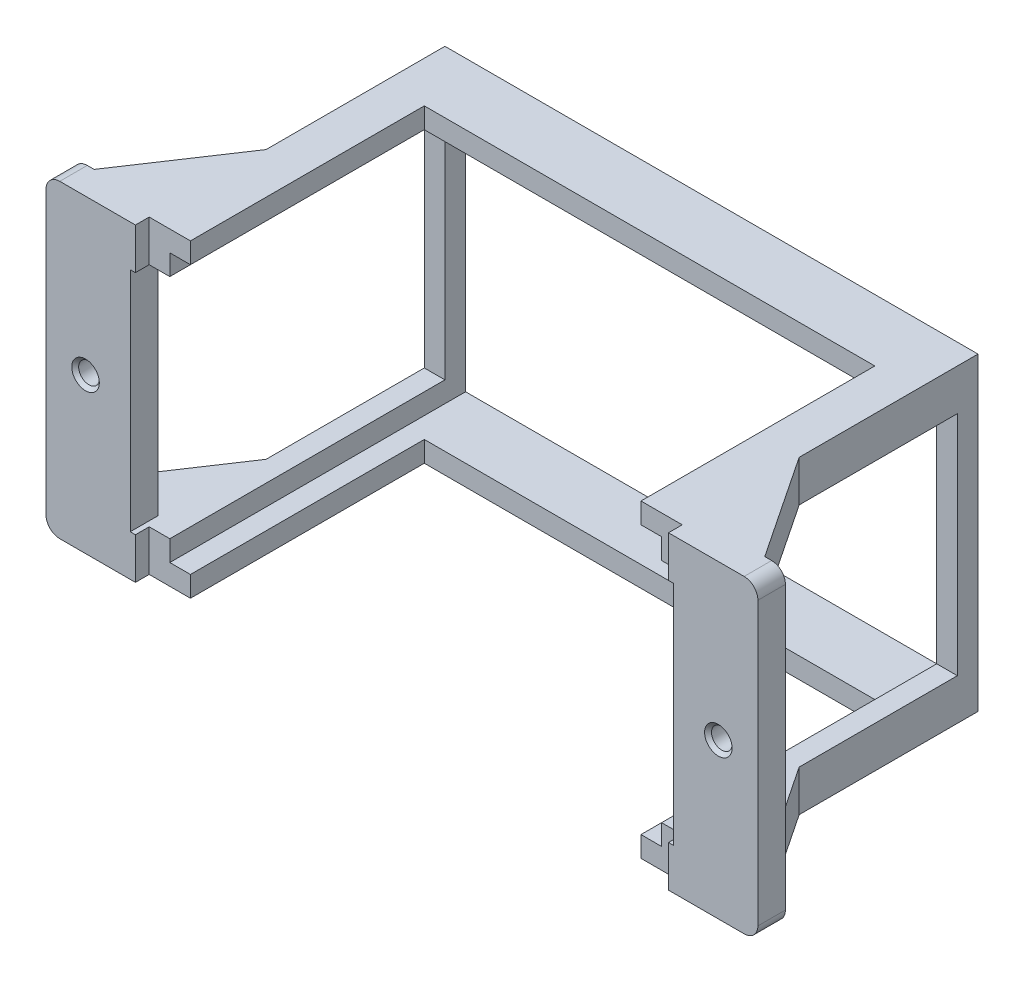
from build123d import *

# Parameters (mm, degrees)
SKETCH_1_W             = 77.5
SKETCH_1_H             = 45
SKETCH_1_W_2           = 71.5
SKETCH_1_H_2           = 39
EXTRUDE_1_DEPTH        = 3
SKETCH_2_W             = 3
SKETCH_2_H             = 3
EXTRUDE_2_DEPTH        = 40
SKETCH_3_W             = 3
SKETCH_3_H             = 3
EXTRUDE_3_DEPTH        = 40
EXTRUDE_4_DEPTH        = 2
EXTRUDE_4_DEPTH_BACK   = 2
EXTRUDE_4_2_DEPTH      = 2
EXTRUDE_4_2_DEPTH_BACK = 2
SKETCH_5_W             = 65.5
SKETCH_5_H             = 6
EXTRUDE_5_DEPTH        = 3
SKETCH_6_W             = 65.5
SKETCH_6_H             = 6
EXTRUDE_6_DEPTH        = 3
SKETCH_7_R             = 1.5
CUT_EXTRUDE_1_DEPTH    = 5
CHAMFER_1_SIZE         = 0.5
CHAMFER_2_SIZE         = 0.5
CHAMFER_3_SIZE         = 2
CHAMFER_4_SIZE         = 2
EXTRUDE_7_DEPTH        = 6
MIRROR_2_COPY_1_DEPTH  = 6
MIRROR_2_COPY_2_DEPTH  = 6
SKETCH_9_W             = 2
SKETCH_9_H             = 45
CUT_EXTRUDE_2_DEPTH    = 10
FILLET_1_R             = 2


with BuildPart() as part:
    # 草图1 → 凸台-拉伸1 (new body)
    with BuildSketch(Plane.XY):
        Rectangle(SKETCH_1_W, SKETCH_1_H)
        Rectangle(SKETCH_1_W_2, SKETCH_1_H_2, mode=Mode.SUBTRACT)
    extrude(amount=EXTRUDE_1_DEPTH)

    # 草图2 → 凸台-拉伸2 (add)
    with BuildSketch(Plane.XY.offset(3)):
        with Locations((37.25, 21)):
            Rectangle(SKETCH_2_W, SKETCH_2_H)
        with Locations((-37.25, 21)):
            Rectangle(SKETCH_2_W, SKETCH_2_H)
        with Locations((-37.25, -21)):
            Rectangle(SKETCH_2_W, SKETCH_2_H)
        with Locations((37.25, -21)):
            Rectangle(SKETCH_2_W, SKETCH_2_H)
    extrude(amount=EXTRUDE_2_DEPTH)

    # 草图3 → 凸台-拉伸3 (add)
    with BuildSketch(Plane.XY.offset(3)):
        with Locations((34.25, -21)):
            Rectangle(SKETCH_3_W, SKETCH_3_H)
        with Locations((37.25, 18)):
            Rectangle(SKETCH_3_W, SKETCH_3_H)
        with Locations((34.25, 21)):
            Rectangle(SKETCH_3_W, SKETCH_3_H)
        with Locations((37.25, -18)):
            Rectangle(SKETCH_3_W, SKETCH_3_H)
        with Locations((-34.25, 21)):
            Rectangle(SKETCH_3_W, SKETCH_3_H)
        with Locations((-37.25, 18)):
            Rectangle(SKETCH_3_W, SKETCH_3_H)
        with Locations((-37.25, -18)):
            Rectangle(SKETCH_3_W, SKETCH_3_H)
        with Locations((-34.25, -21)):
            Rectangle(SKETCH_3_W, SKETCH_3_H)
    extrude(amount=EXTRUDE_3_DEPTH)

    # 草图5 → 凸台-拉伸5 (add)
    with BuildSketch(Plane(origin=(0, 22.5, 0), x_dir=(1, 0, 0), z_dir=(0, 1, 0))):
        with Locations((0, -6)):
            Rectangle(SKETCH_5_W, SKETCH_5_H)
    extrude(amount=-EXTRUDE_5_DEPTH)


with BuildPart() as body_2:
    # 草图4 → 凸台-拉伸4 (new, two sides: drawn at the far end of the back side and taken through both)
    with BuildSketch(Plane.XY.offset(43).offset(-EXTRUDE_4_DEPTH_BACK)):
        Polygon((38.75, 22.5), (53.75, 22.5), (53.75, -22.5), (38.75, -22.5), (38.75, -16.5), (39.5, -16.5), (39.5, 16.5), (38.75, 16.5), align=None)
    extrude(amount=EXTRUDE_4_DEPTH + EXTRUDE_4_DEPTH_BACK)


with BuildPart() as body_3:
    # 草图4 → Extrude 4 2 (new, two sides: drawn at the far end of the back side and taken through both)
    with BuildSketch(Plane.XY.offset(43).offset(-EXTRUDE_4_2_DEPTH_BACK)):
        Polygon((-38.75, -16.5), (-38.75, -22.5), (-53.75, -22.5), (-53.75, 22.5), (-38.75, 22.5), (-38.75, 16.5), (-39.5, 16.5), (-39.5, -16.5), align=None)
    extrude(amount=EXTRUDE_4_2_DEPTH + EXTRUDE_4_2_DEPTH_BACK)


with BuildPart() as body_4:
    # 草图6 → 凸台-拉伸6 (new body)
    with BuildSketch(Plane.XZ.offset(22.5)):
        with Locations((0, 6)):
            Rectangle(SKETCH_6_W, SKETCH_6_H)
    extrude(amount=-EXTRUDE_6_DEPTH)


with BuildPart() as cut_extrude_1_tool:
    # 草图7 → 切除-拉伸1 (new body)
    with BuildSketch(Plane.XY.offset(45)):
        with Locations((-46, 0)):
            Circle(SKETCH_7_R)
        with Locations((46, 0)):
            Circle(SKETCH_7_R)
    extrude(amount=-CUT_EXTRUDE_1_DEPTH)


with BuildPart() as body_2_1:
    add(body_2.part)

    # 切除-拉伸1: cut by cut_extrude_1_tool
    add(cut_extrude_1_tool.part, mode=Mode.SUBTRACT)

    # 倒角2
    chamfer_2_edges = [body_2_1.edges().sort_by_distance(p)[0] for p in [
        (44.5, 0, 45),
    ]]
    chamfer(chamfer_2_edges, length=CHAMFER_2_SIZE)

    # 倒角3
    chamfer_3_edges = [body_2_1.edges().sort_by_distance(p)[0] for p in [
        (53.75, -22.5, 43),
        (53.75, 22.5, 43),
    ]]
    chamfer(chamfer_3_edges, length=CHAMFER_3_SIZE)


with BuildPart() as body_3_1:
    add(body_3.part)

    # 切除-拉伸1: cut by cut_extrude_1_tool
    add(cut_extrude_1_tool.part, mode=Mode.SUBTRACT)

    # 倒角1
    chamfer_1_edges = [body_3_1.edges().sort_by_distance(p)[0] for p in [
        (-47.5, 0, 45),
    ]]
    chamfer(chamfer_1_edges, length=CHAMFER_1_SIZE)


with BuildPart() as part_1:
    add(part.part)

    # Combine 1: union body 3
    add(body_3_1.part)


with BuildPart() as body_4_1:
    add(body_4.part)

    # Combine 2: union part
    add(part_1.part)


with BuildPart() as body_2_2:
    add(body_2_1.part)

    # Combine 3: union body 4
    add(body_4_1.part)

    # 倒角4
    chamfer_4_edges = [body_2_2.edges().sort_by_distance(p)[0] for p in [
        (-53.75, -22.5, 43),
        (-53.75, 22.5, 43),
    ]]
    chamfer(chamfer_4_edges, length=CHAMFER_4_SIZE)

    # 草图8 → 凸台-拉伸7 (add)
    with BuildSketch(Plane(origin=(0, 22.5, 0), x_dir=(1, 0, 0), z_dir=(0, 1, 0))):
        Polygon((48.75, -41), (38.75, -26), (38.75, -41), align=None)
    extrude_7 = extrude(amount=-EXTRUDE_7_DEPTH)

    # 镜向1: 凸台-拉伸7 across plane
    add(extrude_7.mirror(Plane(origin=(0, 0, 0), x_dir=(0, 0, 1), z_dir=(1, 0, 0))))

    # 镜向2 copy 1 sketch → 镜向2 copy 1 (add)
    with BuildSketch(Plane(origin=(0, -22.5, 0), x_dir=(-1, 0, 0), z_dir=(0, -1, 0))):
        Polygon((48.75, -41), (38.75, -26), (38.75, -41), align=None)
    extrude(amount=-MIRROR_2_COPY_1_DEPTH)

    # 镜向2 copy 2 sketch → 镜向2 copy 2 (add)
    with BuildSketch(Plane.XZ.offset(22.5)):
        Polygon((48.75, 41), (38.75, 26), (38.75, 41), align=None)
    extrude(amount=-MIRROR_2_COPY_2_DEPTH)

    # 草图9 → 切除-拉伸2 (cut)
    with BuildSketch(Plane(origin=(0, 0, 41), x_dir=(-1, 0, 0), z_dir=(0, 0, -1))):
        with Locations((52.75, 0)):
            Rectangle(SKETCH_9_W, SKETCH_9_H)
        with Locations((-52.75, 0)):
            Rectangle(SKETCH_9_W, SKETCH_9_H)
    extrude(amount=-CUT_EXTRUDE_2_DEPTH, mode=Mode.SUBTRACT)

    # 圆角1
    fillet_1_edges = [body_2_2.edges().sort_by_distance(p)[0] for p in [
        (-51.75, 22.5, 43),
        (-51.75, -22.5, 43),
        (51.75, -22.5, 43),
        (51.75, 22.5, 43),
    ]]
    fillet(fillet_1_edges, radius=FILLET_1_R)


solid = body_2_2.part
